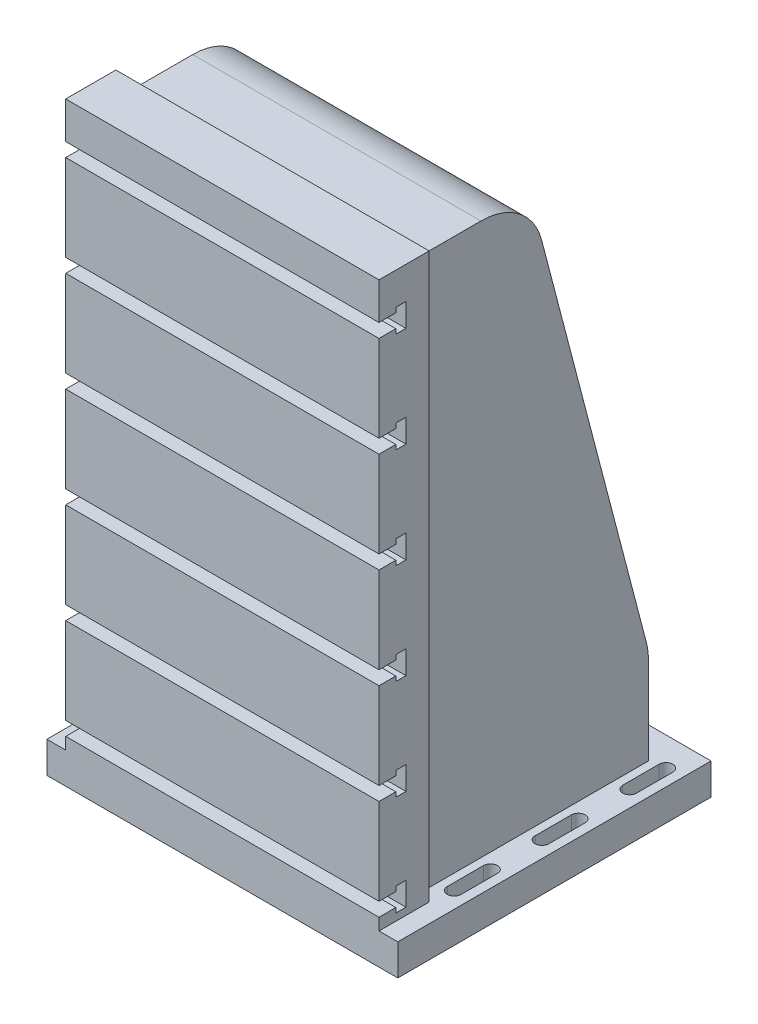
from build123d import *

# Parameters (mm, degrees)
BOSS_EXTRUDE1_DEPTH  = 280
CUT_EXTRUDE2_REACH   = 1068.958
CUT_EXTRUDE3_REACH   = 1111.459
LPATTERN2_COUNT      = 3
LPATTERN2_PITCH      = 140
CUT_EXTRUDE1_REACH   = 1212.826
LPATTERN1_COUNT      = 6
LPATTERN1_PITCH      = 160
MIRROR1_COPY_1_REACH = 1111.459
MIRROR1_COPY_2_REACH = 1111.459


with BuildPart() as part:
    # Sketch4 → Boss-Extrude1 (new, symmetric)
    with BuildSketch(Plane(origin=(0, 0, 0), x_dir=(0, 0, -1), z_dir=(1, 0, 0))):
        with BuildLine():
            Line((0, 0), (0, 950))
            Line((0, 950), (80, 950))
            Line((80, 950), (80, 930))
            Line((80, 930), (182.772011822, 930))
            ThreePointArc((182.772011822, 930), (243.894588799, 909.145628961), (279.523707794, 855.280611672))
            Line((279.523707794, 855.280611672), (446.751695972, 215.280611672))
            ThreePointArc((446.751695972, 215.280611672), (449.184599604, 202.744222275), (450, 190))
            Line((450, 190), (450, 50))
            Line((450, 50), (500, 50))
            Line((500, 50), (500, 0))
            Line((500, 0), (0, 0))
        make_face()
    extrude(amount=BOSS_EXTRUDE1_DEPTH, both=True)

    # Sketch9 → Cut-Extrude2 (cut, up to next)
    with BuildSketch(Plane(origin=(0, 50, 0), x_dir=(1, 0, 0), z_dir=(0, 1, 0)), mode=Mode.PRIVATE) as cut_extrude2_sk1:
        Polygon((-230, 80), (-250, 80), (-250, -10), (-330, -10), (-330, 560), (-230, 560), align=None)
    cut_extrude2_tool1 = extrude(cut_extrude2_sk1.sketch, amount=CUT_EXTRUDE2_REACH, mode=Mode.PRIVATE) & part.part
    cut_extrude2 = cut_extrude2_tool1.solids().sort_by_distance((-281.304348, 50, -282.826087))[0]
    add(cut_extrude2, mode=Mode.SUBTRACT)

    # Sketch10 → Cut-Extrude3 (cut, up to next)
    with BuildSketch(Plane.XZ, mode=Mode.PRIVATE) as cut_extrude3_sk1:
        with BuildLine():
            Line((-243, -116), (-243, -174))
            ThreePointArc((-243, -174), (-254, -185), (-265, -174))
            Line((-265, -174), (-265, -116))
            ThreePointArc((-265, -116), (-254, -105), (-243, -116))
        make_face()
    cut_extrude3_tool1 = extrude(cut_extrude3_sk1.sketch, amount=-CUT_EXTRUDE3_REACH, mode=Mode.PRIVATE) & part.part
    cut_extrude3 = cut_extrude3_tool1.solids().sort_by_distance((-254, 0, -145))[0]
    add(cut_extrude3, mode=Mode.SUBTRACT)

    # LPattern2: Cut-Extrude3 ×3
    with Locations(*[(0, 0, -i * LPATTERN2_PITCH) for i in range(1, LPATTERN2_COUNT)]):
        add(cut_extrude3, mode=Mode.SUBTRACT)

    # Sketch6 → Cut-Extrude1 (cut, up to next)
    with BuildSketch(Plane(origin=(280, 0, 0), x_dir=(0, 0, -1), z_dir=(1, 0, 0)), mode=Mode.PRIVATE) as cut_extrude1_sk1:
        Polygon((0, 69), (0, 91), (26.9, 91), (26.9, 98.6), (43, 98.6), (43, 61.4), (26.9, 61.4), (26.9, 69), align=None)
    cut_extrude1_tool1 = extrude(cut_extrude1_sk1.sketch, amount=-CUT_EXTRUDE1_REACH, mode=Mode.PRIVATE) & part.part
    cut_extrude1 = cut_extrude1_tool1.solids().sort_by_distance((280, 80, -24.26428))[0]
    add(cut_extrude1, mode=Mode.SUBTRACT)

    # LPattern1: Cut-Extrude1 ×6
    with Locations(*[(0, i * LPATTERN1_PITCH, 0) for i in range(1, LPATTERN1_COUNT)]):
        add(cut_extrude1, mode=Mode.SUBTRACT)

    # Mirror1: Cut-Extrude2, Cut-Extrude3 across plane
    add(cut_extrude2.mirror(Plane(origin=(0, 0, 0), x_dir=(0, 0, 1), z_dir=(1, 0, 0))), mode=Mode.SUBTRACT)
    add(cut_extrude3.mirror(Plane(origin=(0, 0, 0), x_dir=(0, 0, 1), z_dir=(1, 0, 0))), mode=Mode.SUBTRACT)

    # Mirror1 copy 1 sketch → Mirror1 copy 1 (cut, up to next)
    with BuildSketch(Plane(origin=(0, 0, -140), x_dir=(-1, 0, 0), z_dir=(0, -1, 0)), mode=Mode.PRIVATE) as mirror1_copy_1_sk1:
        with BuildLine():
            Line((-243, 116), (-243, 174))
            ThreePointArc((-243, 174), (-254, 185), (-265, 174))
            Line((-265, 174), (-265, 116))
            ThreePointArc((-265, 116), (-254, 105), (-243, 116))
        make_face()
    mirror1_copy_1_tool1 = extrude(mirror1_copy_1_sk1.sketch, amount=-MIRROR1_COPY_1_REACH, mode=Mode.PRIVATE) & part.part
    add(mirror1_copy_1_tool1.solids().sort_by_distance((254, 0, -285))[0], mode=Mode.SUBTRACT)

    # Mirror1 copy 2 sketch → Mirror1 copy 2 (cut, up to next)
    with BuildSketch(Plane(origin=(0, 0, -280), x_dir=(-1, 0, 0), z_dir=(0, -1, 0)), mode=Mode.PRIVATE) as mirror1_copy_2_sk1:
        with BuildLine():
            Line((-243, 116), (-243, 174))
            ThreePointArc((-243, 174), (-254, 185), (-265, 174))
            Line((-265, 174), (-265, 116))
            ThreePointArc((-265, 116), (-254, 105), (-243, 116))
        make_face()
    mirror1_copy_2_tool1 = extrude(mirror1_copy_2_sk1.sketch, amount=-MIRROR1_COPY_2_REACH, mode=Mode.PRIVATE) & part.part
    add(mirror1_copy_2_tool1.solids().sort_by_distance((254, 0, -425))[0], mode=Mode.SUBTRACT)


solid = part.part
